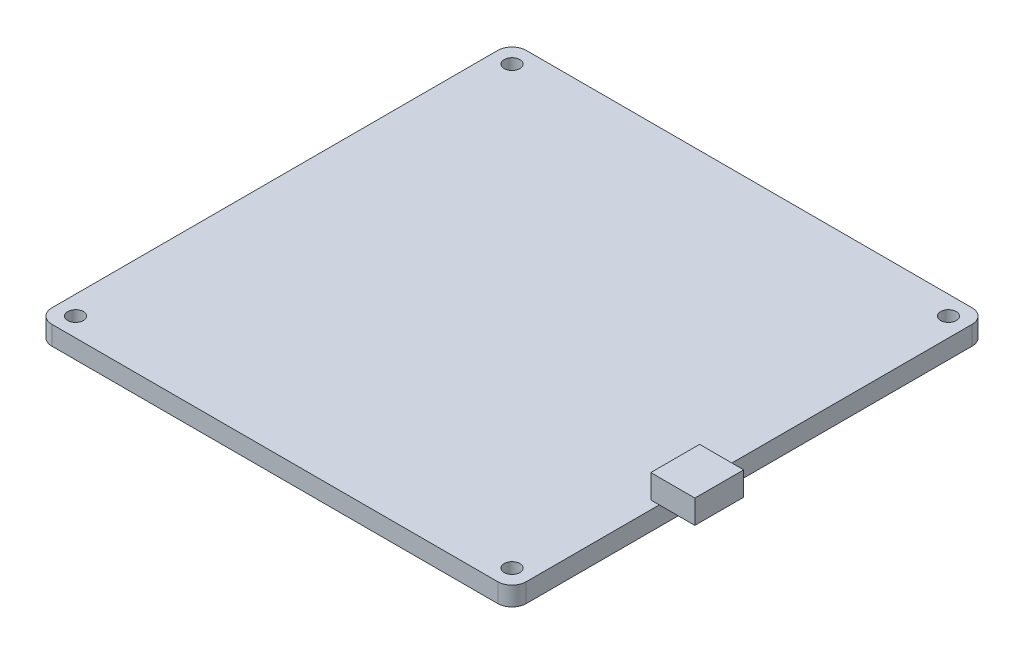
from build123d import *

# Parameters (mm, degrees)
SKETCH_1_W      = 100
SKETCH_1_H      = 100
SKETCH_1_R      = 1.65
EXTRUDE_1_DEPTH = 4
FILLET_1_R      = 3
SKETCH_2_W      = 9.3
SKETCH_2_H      = 10.3
EXTRUDE_2_DEPTH = 5


with BuildPart() as part:
    # 草图1 → 凸台-拉伸1 (new body)
    with BuildSketch(Plane(origin=(0, 0, 0), x_dir=(1, 0, 0), z_dir=(0, 1, 0))):
        Rectangle(SKETCH_1_W, SKETCH_1_H)
        with Locations(Location((-46, 46, 0), (0, 0, 270))):
            Circle(SKETCH_1_R, mode=Mode.SUBTRACT)
        with Locations(Location((46, 46, 0), (0, 0, 270))):
            Circle(SKETCH_1_R, mode=Mode.SUBTRACT)
        with Locations(Location((46, -46, 0), (0, 0, 270))):
            Circle(SKETCH_1_R, mode=Mode.SUBTRACT)
        with Locations(Location((-46, -46, 0), (0, 0, 270))):
            Circle(SKETCH_1_R, mode=Mode.SUBTRACT)
    extrude(amount=EXTRUDE_1_DEPTH)

    # 圆角1
    fillet_1_edges = [part.edges().sort_by_distance(p)[0] for p in [
        (50, 2, 50),
        (-50, 2, 50),
        (-50, 2, -50),
        (50, 2, -50),
    ]]
    fillet(fillet_1_edges, radius=FILLET_1_R)

    # 草图2 → 凸台-拉伸2 (add)
    with BuildSketch(Plane(origin=(0, 4, 0), x_dir=(1, 0, 0), z_dir=(0, 1, 0))):
        with Locations((52.85, -13.8)):
            Rectangle(SKETCH_2_W, SKETCH_2_H)
    extrude(amount=EXTRUDE_2_DEPTH)


solid = part.part
